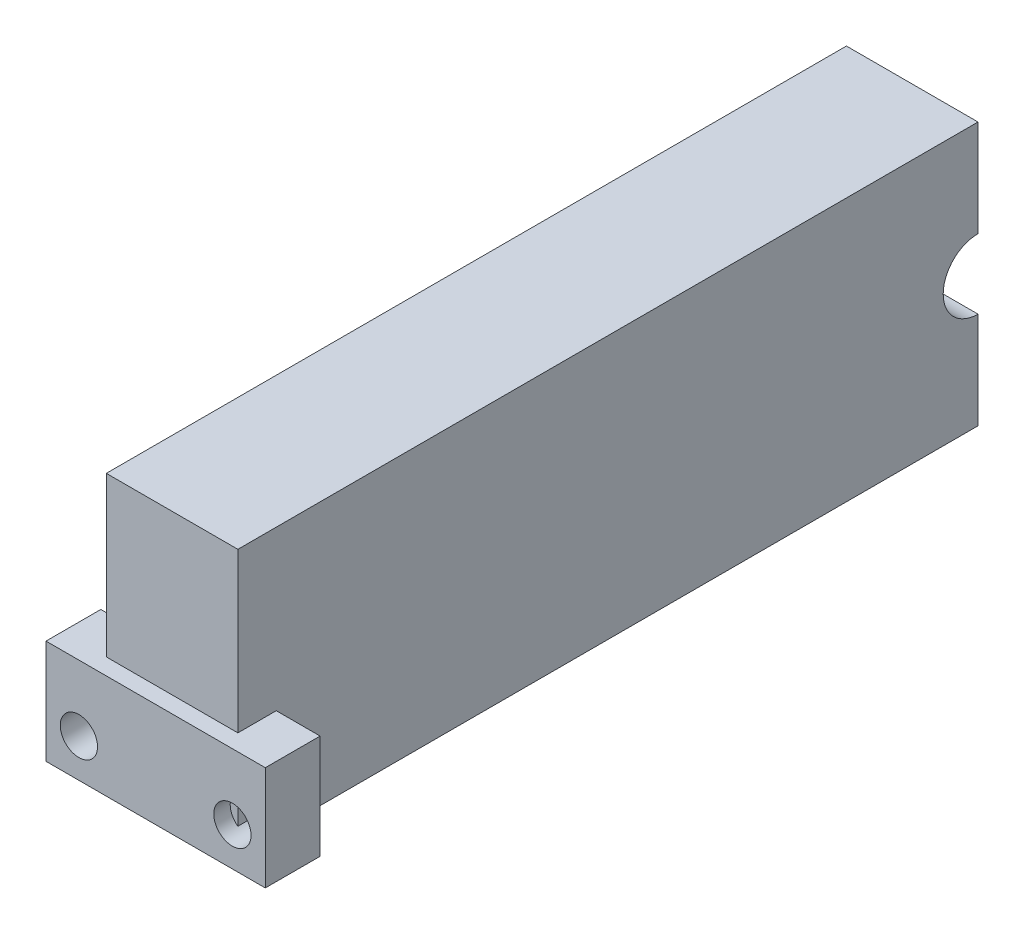
from build123d import *

# Parameters (mm, degrees)
FIVE_MM_ATTACHMENT_FOOT_START                    = -5
SKETCH1_W                                        = 20
SKETCH1_H                                        = 9.5
SKETCH1_R                                        = 1.7
FIVE_MM_ATTACHMENT_FOOT_DEPTH                    = 5
DEEP_ACTUATOR_WEB_START                          = -69
SKETCH2_W                                        = 12
SKETCH2_H                                        = 24
DEEP_ACTUATOR_WEB_DEPTH                          = 67.5
QUARTER20_AXIAL_THREAD_MAJOR_ENVELOPE_DEPTH      = 90.516758208
QUARTER20_AXIAL_THREAD_MAJOR_ENVELOPE_DEPTH_BACK = 90.516758208
SKETCH3_R                                        = 3.175


with BuildPart() as part:
    # Sketch1 → Five_mm_Attachment_Foot (new body)
    with BuildSketch(Plane.XY.offset(FIVE_MM_ATTACHMENT_FOOT_START)):
        with Locations((-20, 29.25)):
            Rectangle(SKETCH1_W, SKETCH1_H)
        with Locations((-27, 28)):
            Circle(SKETCH1_R, mode=Mode.SUBTRACT)
        with Locations((-13, 28)):
            Circle(SKETCH1_R, mode=Mode.SUBTRACT)
    extrude(amount=FIVE_MM_ATTACHMENT_FOOT_DEPTH)

    # Sketch2 → Deep_Actuator_Web (add)
    with BuildSketch(Plane.XY.offset(DEEP_ACTUATOR_WEB_START)):
        with Locations((-20, 36.5)):
            Rectangle(SKETCH2_W, SKETCH2_H)
    extrude(amount=DEEP_ACTUATOR_WEB_DEPTH)

    # Sketch3 → Quarter20_Axial_Thread_Major_Envelope (cut, two sides: drawn at the far end of the back side and taken through both)
    with BuildSketch(Plane(origin=(0, 0, 0), x_dir=(0, 0, -1), z_dir=(1, 0, 0)).offset(-QUARTER20_AXIAL_THREAD_MAJOR_ENVELOPE_DEPTH_BACK)):
        with Locations((69, 36.5)):
            Circle(SKETCH3_R)
    extrude(amount=QUARTER20_AXIAL_THREAD_MAJOR_ENVELOPE_DEPTH + QUARTER20_AXIAL_THREAD_MAJOR_ENVELOPE_DEPTH_BACK, mode=Mode.SUBTRACT)


solid = part.part
